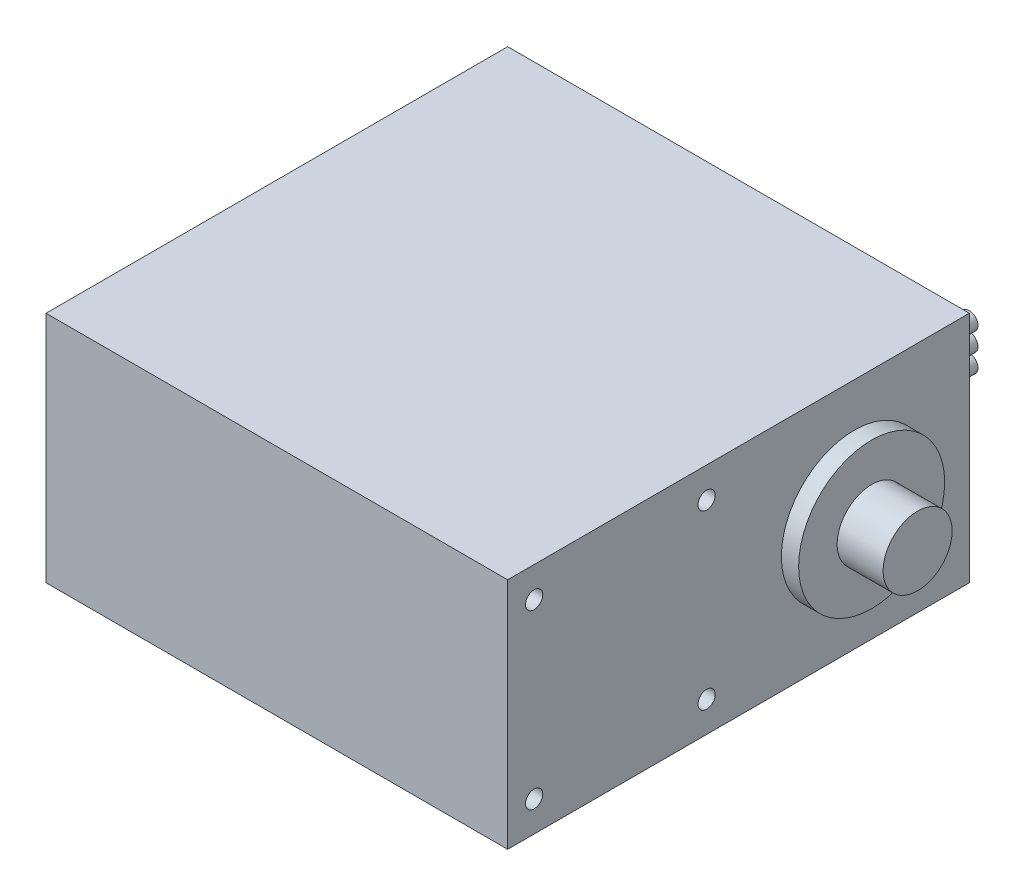
from build123d import *

# Parameters (mm, degrees)
ESQUISSE1_W                       = 40.15
ESQUISSE1_H                       = 40.15
BOSS_EXTRU_1_DEPTH                = 10.15
ESQUISSE3_R                       = 6.15
BOSS_EXTRU_2_DEPTH                = 1.5
ESQUISSE4_R                       = 2.9
BOSS_EXTRU_3_DEPTH                = 4.35
DIAM_TRE_DU_PER_AGE_3_0_3_1_D     = 3
DIAM_TRE_DU_PER_AGE_3_0_3_1_DEPTH = 6
DIAM_TRE_DU_PER_AGE_3_0_3_1_TIP   = 0.901290929
ESQUISSE5_R                       = 6.35
BOSS_EXTRU_4_DEPTH                = 1.5
ESQUISSE6_R                       = 3
BOSS_EXTRU_5_DEPTH                = 4
ESQUISSE7_W                       = 4
ESQUISSE7_H                       = 8.3
BOSS_EXTRU_6_DEPTH                = 4
ESQUISSE8_R                       = 0.75
BOSS_EXTRU_8_DEPTH                = 4
ESQUISSE9_R                       = 0.75
ENL_V_MAT_EXTRU_1_DEPTH           = 5
ESQUISSE10_R                      = 0.75
ENL_V_MAT_EXTRU_2_DEPTH           = 5


with BuildPart() as part:
    # Esquisse1 → Boss.-Extru.1 (new, symmetric)
    with BuildSketch(Plane(origin=(0, 0, 0), x_dir=(1, 0, 0), z_dir=(0, 1, 0))):
        Rectangle(ESQUISSE1_W, ESQUISSE1_H)
    extrude(amount=BOSS_EXTRU_1_DEPTH, both=True)

    # Esquisse3 → Boss.-Extru.2 (add)
    with BuildSketch(Plane.ZY.offset(20.075)):
        with Locations((-10.075, 0)):
            Circle(ESQUISSE3_R)
    extrude(amount=BOSS_EXTRU_2_DEPTH)

    # Esquisse4 → Boss.-Extru.3 (add)
    with BuildSketch(Plane.ZY.offset(21.575)):
        with Locations((-10.075, 0)):
            Circle(ESQUISSE4_R)
    extrude(amount=BOSS_EXTRU_3_DEPTH)

    # Diamètre du perçage Ø3.0 (3)1
    with Locations(Plane.ZY.offset(25.925)):
        with Locations((-10.075, 0)):
            Hole(DIAM_TRE_DU_PER_AGE_3_0_3_1_D / 2, depth=DIAM_TRE_DU_PER_AGE_3_0_3_1_DEPTH)
            with Locations((0, 0, -(DIAM_TRE_DU_PER_AGE_3_0_3_1_DEPTH + DIAM_TRE_DU_PER_AGE_3_0_3_1_TIP / 2))):  # 118° drill point
                Cone(0, DIAM_TRE_DU_PER_AGE_3_0_3_1_D / 2, DIAM_TRE_DU_PER_AGE_3_0_3_1_TIP, mode=Mode.SUBTRACT)

    # Esquisse5 → Boss.-Extru.4 (add)
    with BuildSketch(Plane(origin=(20.075, 0, 0), x_dir=(0, 0, -1), z_dir=(1, 0, 0))):
        with Locations((10.075, 0)):
            Circle(ESQUISSE5_R)
    extrude(amount=BOSS_EXTRU_4_DEPTH)

    # Esquisse6 → Boss.-Extru.5 (add)
    with BuildSketch(Plane(origin=(21.575, 0, 0), x_dir=(0, 0, -1), z_dir=(1, 0, 0))):
        with Locations((10.075, 0)):
            Circle(ESQUISSE6_R)
    extrude(amount=BOSS_EXTRU_5_DEPTH)

    # Esquisse7 → Boss.-Extru.6 (add)
    with BuildSketch(Plane(origin=(0, 0, -20.075), x_dir=(-1, 0, 0), z_dir=(0, 0, -1))):
        with Locations((-12.075, 0)):
            Rectangle(ESQUISSE7_W, ESQUISSE7_H)
    extrude(amount=BOSS_EXTRU_6_DEPTH)

    # Esquisse8 → Boss.-Extru.8 (add)
    with BuildSketch(Plane(origin=(0, 0, -24.075), x_dir=(-1, 0, 0), z_dir=(0, 0, -1))):
        with Locations((-12.075, 0)):
            Circle(ESQUISSE8_R)
        with Locations((-12.075, -1.6)):
            Circle(ESQUISSE8_R)
        with Locations((-12.075, 1.6)):
            Circle(ESQUISSE8_R)
    extrude(amount=BOSS_EXTRU_8_DEPTH)

    # Esquisse9 → Enlèv. mat.-Extru.1 (cut)
    with BuildSketch(Plane(origin=(20.075, 0, 0), x_dir=(0, 0, -1), z_dir=(1, 0, 0))):
        with Locations((-17.775, 7.5)):
            Circle(ESQUISSE9_R)
        with Locations((-2.775, 7.5)):
            Circle(ESQUISSE9_R)
        with Locations((-17.775, -7.5)):
            Circle(ESQUISSE9_R)
        with Locations((-2.775, -7.5)):
            Circle(ESQUISSE9_R)
    extrude(amount=-ENL_V_MAT_EXTRU_1_DEPTH, mode=Mode.SUBTRACT)

    # Esquisse10 → Enlèv. mat.-Extru.2 (cut)
    with BuildSketch(Plane.ZY.offset(20.075)):
        with Locations((17.275, 0)):
            Circle(ESQUISSE10_R)
        with Locations((10.275, 7)):
            Circle(ESQUISSE10_R)
        with Locations((10.275, -7)):
            Circle(ESQUISSE10_R)
    extrude(amount=-ENL_V_MAT_EXTRU_2_DEPTH, mode=Mode.SUBTRACT)


solid = part.part
